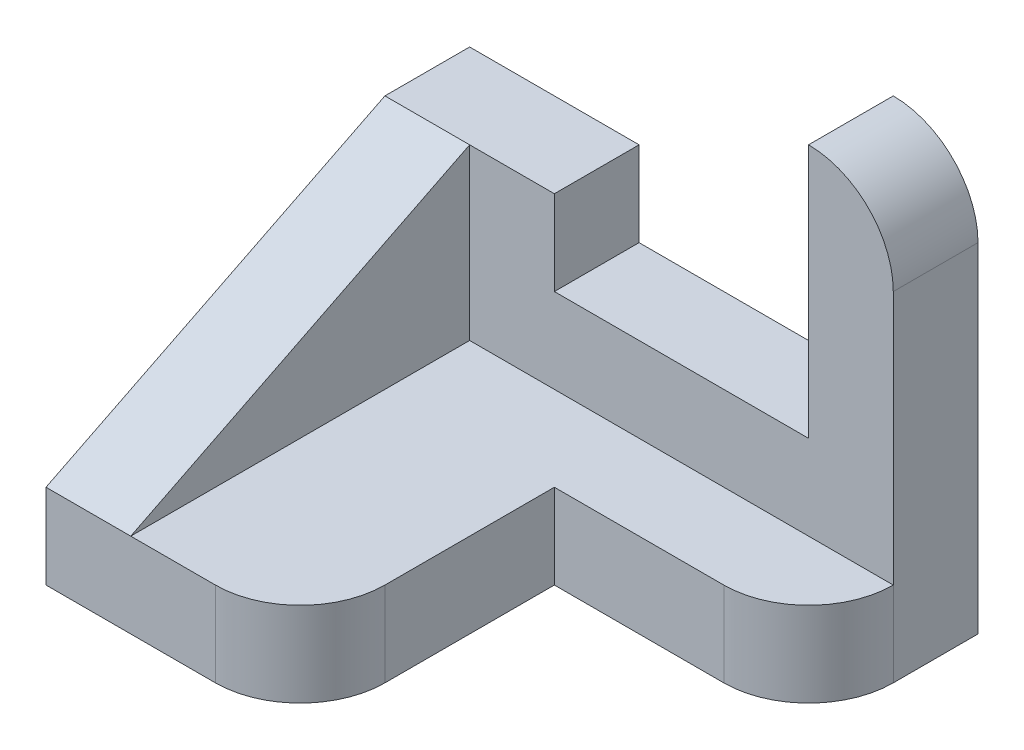
from build123d import *

# Parameters (mm, degrees)
BOSS_EXTRUDE1_DEPTH = 10
BOSS_EXTRUDE2_DEPTH = 10
BOSS_EXTRUDE3_DEPTH = 10


with BuildPart() as part:
    # Sketch1 → Boss-Extrude1 (new body)
    with BuildSketch(Plane(origin=(0, 0, 0), x_dir=(1, 0, 0), z_dir=(0, 1, 0))):
        with BuildLine():
            Line((20, 5), (0, 5))
            Line((0, 5), (0, -15))
            ThreePointArc((0, -15), (-2.928932188, -22.071067812), (-10, -25))
            Line((-10, -25), (-30, -25))
            Line((-30, -25), (-30, 25))
            Line((-30, 25), (30, 25))
            Line((30, 25), (30, 15))
            ThreePointArc((30, 15), (27.071067812, 7.928932188), (20, 5))
        make_face()
    extrude(amount=BOSS_EXTRUDE1_DEPTH)

    # Sketch2 → Boss-Extrude2 (add)
    with BuildSketch(Plane(origin=(0, 0, -25), x_dir=(-1, 0, 0), z_dir=(0, 0, -1))):
        with BuildLine():
            Line((-30, 10), (-30, 40))
            ThreePointArc((-30, 40), (-27.071067812, 47.071067812), (-20, 50))
            Line((-20, 50), (-20, 20))
            Line((-20, 20), (10, 20))
            Line((10, 20), (10, 30))
            Line((10, 30), (30, 30))
            Line((30, 30), (30, 10))
            Line((30, 10), (-30, 10))
        make_face()
    extrude(amount=-BOSS_EXTRUDE2_DEPTH)

    # Sketch3 → Boss-Extrude3 (add)
    with BuildSketch(Plane.ZY.offset(30)):
        Polygon((-15, 30), (25, 10), (-15, 10), align=None)
    extrude(amount=-BOSS_EXTRUDE3_DEPTH)


solid = part.part
